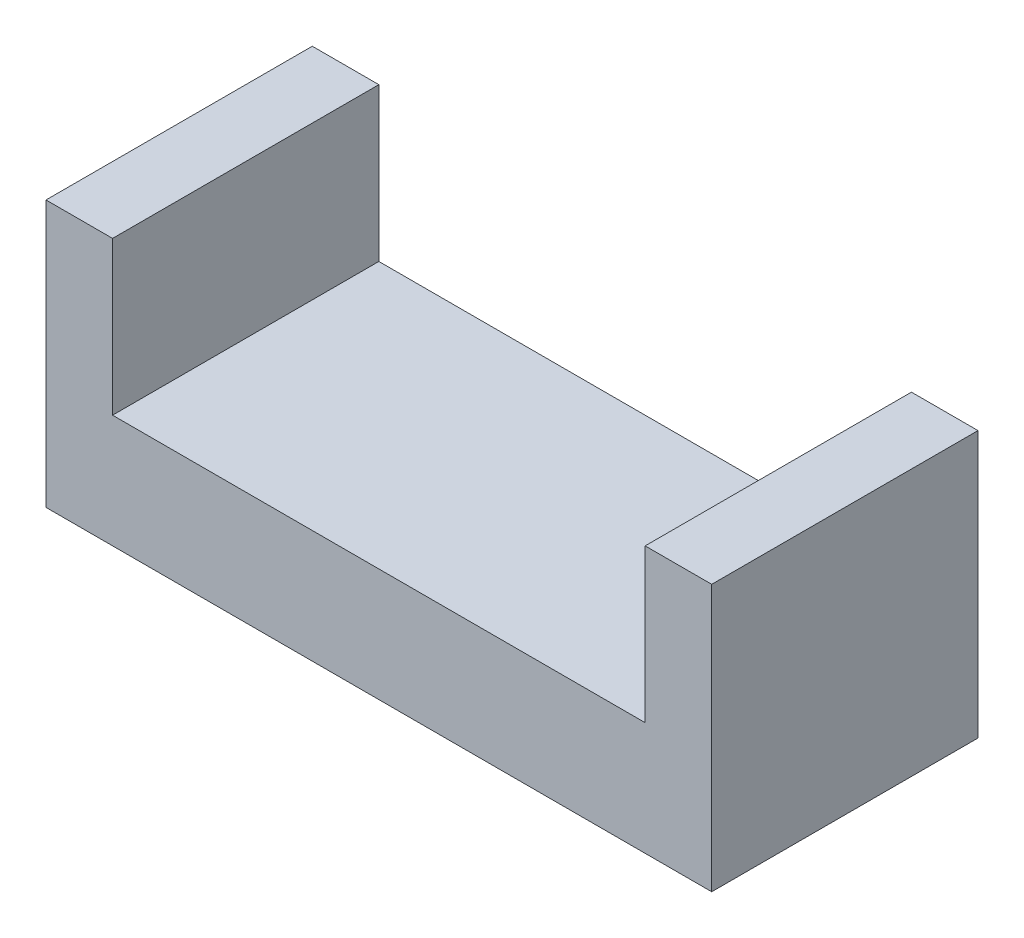
from build123d import *

# Parameters (mm, degrees)
EXTRUDE_1_DEPTH = 20


with BuildPart() as part:
    # 草圖1 → 填料-伸長1 (new body)
    with BuildSketch(Plane.XY):
        Polygon((-20, 10), (-25, 10), (-25, -10), (25, -10), (25, 10), (20, 10), (20, -1.5), (-20, -1.5), align=None)
    extrude(amount=EXTRUDE_1_DEPTH)


solid = part.part
